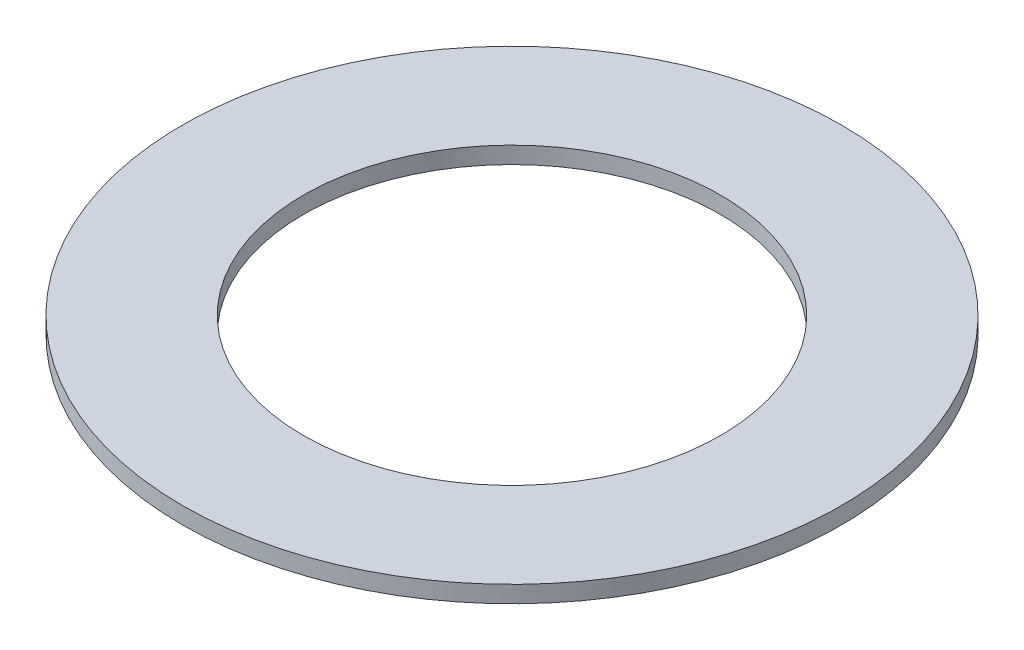
from build123d import *

# Parameters (mm, degrees)
SKETCH1_R           = 78.35
SKETCH1_R_2         = 49.55
BOSS_EXTRUDE1_DEPTH = 4


with BuildPart() as part:
    # Sketch1 → Boss-Extrude1 (new body)
    with BuildSketch(Plane(origin=(0, 0, 0), x_dir=(1, 0, 0), z_dir=(0, 1, 0))):
        with Locations(Location((0, 0, 0), (0, 0, 270))):
            Circle(SKETCH1_R)
        with Locations(Location((0, 0, 0), (0, 0, 270))):
            Circle(SKETCH1_R_2, mode=Mode.SUBTRACT)
    extrude(amount=BOSS_EXTRUDE1_DEPTH)


solid = part.part
